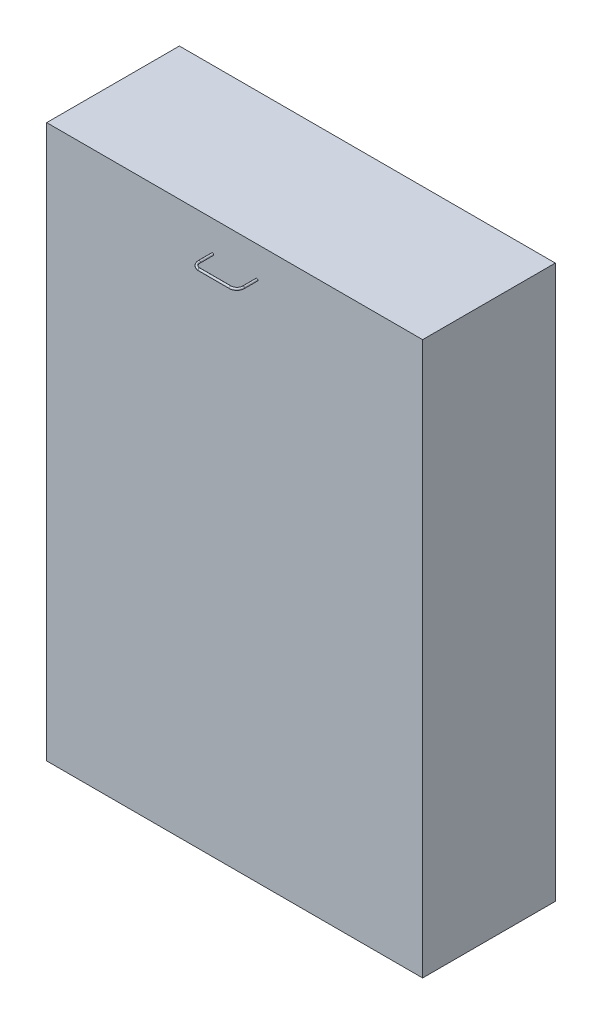
from build123d import *

# Parameters (mm, degrees)
CROQUIS1_W              = 850
CROQUIS1_H              = 1250
SALIENTE_EXTRUIR1_DEPTH = 300
CROQUIS3_R              = 2.5


with BuildPart() as part:
    # Croquis1 → Saliente-Extruir1 (new body)
    with BuildSketch(Plane.XY):
        with Locations((0, -555)):
            Rectangle(CROQUIS1_W, CROQUIS1_H)
    extrude(amount=SALIENTE_EXTRUIR1_DEPTH)

    # Barrer1: sweep along a path in Croquis2
    with BuildLine(Plane(origin=(0, 0, 0), x_dir=(1, 0, 0), z_dir=(0, 1, 0))) as barrer1_path:
        Line((-50, -300), (-50, -330))
        ThreePointArc((-50, -330), (-45.606601718, -340.606601718), (-35, -345))
        Line((-35, -345), (35, -345))
        ThreePointArc((35, -345), (45.606601718, -340.606601718), (50, -330))
        Line((50, -330), (50, -300))
    # Croquis3 → Barrer1 (sweep)
    with BuildSketch(Plane.XY.offset(300)):
        with Locations((-50, 0)):
            Circle(CROQUIS3_R)
    sweep(path=barrer1_path.line)


solid = part.part
